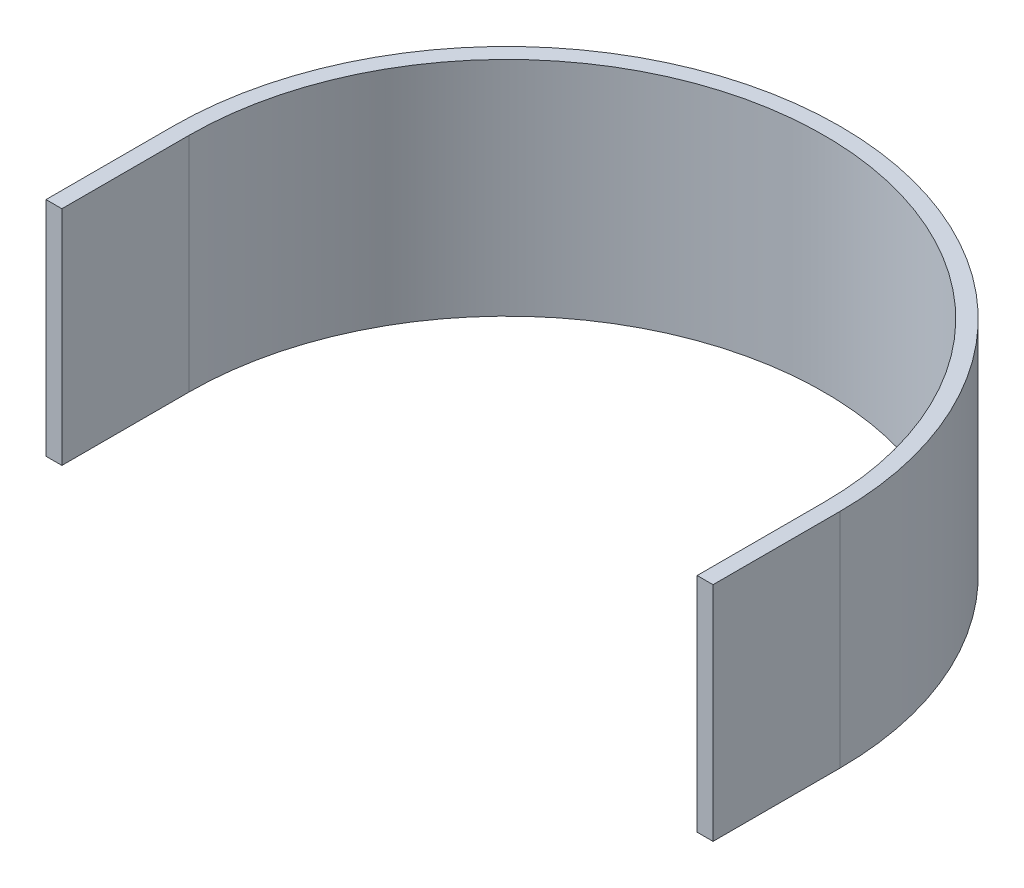
from build123d import *

# Parameters (mm, degrees)
BOSS_EXTRUDE1_DEPTH = 44.45


with BuildPart() as part:
    # Sketch1 → Boss-Extrude1 (new body)
    with BuildSketch(Plane(origin=(0, 0, 0), x_dir=(1, 0, 0), z_dir=(0, 1, 0))):
        with BuildLine():
            ThreePointArc((-66.675, 0), (0, 66.675), (66.675, 0))
            Line((66.675, 0), (66.675, -25.4))
            Line((66.675, -25.4), (63.5, -25.4))
            Line((63.5, -25.4), (63.5, 0))
            ThreePointArc((63.5, 0), (0, 63.5), (-63.5, 0))
            Line((-63.5, 0), (-63.5, -25.4))
            Line((-63.5, -25.4), (-66.675, -25.4))
            Line((-66.675, -25.4), (-66.675, 0))
        make_face()
    extrude(amount=BOSS_EXTRUDE1_DEPTH)


solid = part.part
